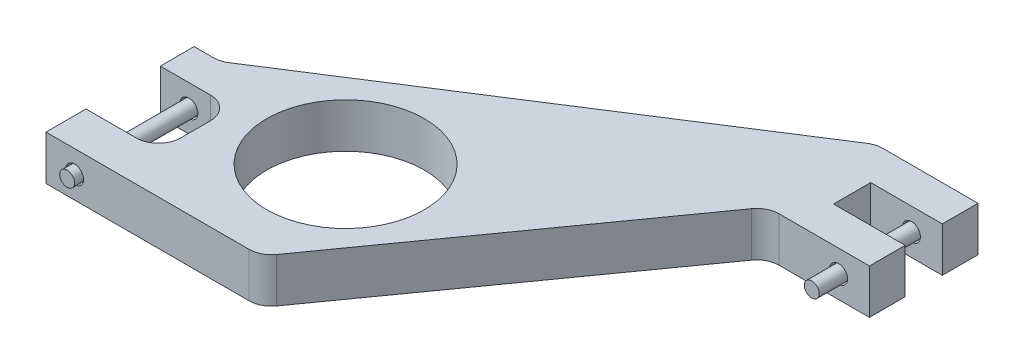
from build123d import *

# Parameters (mm, degrees)
SKETCH21_R     = 13.482411093
EXTRUDE1_DEPTH = 3.81
SKETCH22_R     = 1.524
EXTRUDE2_DEPTH = 64.8716
EXTRUDE3_START = 35.56
SKETCH23_R     = 1.27
EXTRUDE3_DEPTH = 30.574
EXTRUDE4_START = -5.08
SKETCH23_3_R   = 1.27
EXTRUDE4_DEPTH = 23.97


with BuildPart() as part:
    # Sketch21 → Extrude1 (new, symmetric)
    with BuildSketch(Plane(origin=(0, 0, 0), x_dir=(1, 0, 0), z_dir=(0, 1, 0))):
        with BuildLine():
            Line((-88.295770636, -45.311842545), (-79.727880739, -45.311842545))
            ThreePointArc((-79.727880739, -45.311842545), (-77.033803903, -46.427765709), (-75.917880739, -49.121842545))
            Line((-75.917880739, -49.121842545), (-75.917880739, -54.201842545))
            ThreePointArc((-75.917880739, -54.201842545), (-77.033803903, -56.895919382), (-79.727880739, -58.011842545))
            Line((-79.727880739, -58.011842545), (-88.295770636, -58.011842545))
            Line((-88.295770636, -58.011842545), (-88.295770636, -64.854185734))
            Line((-88.295770636, -64.854185734), (-70.51372875, -64.854185734))
            Line((-70.51372875, -64.854185734), (-53.559395609, -64.854185734))
            ThreePointArc((-53.559395609, -64.854185734), (-51.815232505, -64.431514338), (-50.458055152, -63.257280258))
            Line((-50.458055152, -63.257280258), (-16.653859035, -15.885457734))
            ThreePointArc((-16.653859035, -15.885457734), (-15.296681682, -14.711223655), (-13.552518579, -14.288552258))
            Line((-13.552518579, -14.288552258), (1.902726124, -14.288552258))
            Line((1.902726124, -14.288552258), (1.902726124, -8.186070905))
            Line((1.902726124, -8.186070905), (-10.334062324, -8.186070905))
            Line((-10.334062324, -8.186070905), (-10.334062324, -1.836070905))
            Line((-10.334062324, -1.836070905), (1.902726124, -1.836070905))
            Line((1.902726124, -1.836070905), (1.902726124, 4.266410449))
            Line((1.902726124, 4.266410449), (-14.39840261, 4.266410449))
            ThreePointArc((-14.39840261, 4.266410449), (-15.469328765, 4.112804461), (-16.453902861, 3.664372219))
            Line((-16.453902861, 3.664372219), (-82.93238161, -38.931687082))
            ThreePointArc((-82.93238161, -38.931687082), (-83.916955706, -39.380119324), (-84.987881861, -39.533725312))
            Line((-84.987881861, -39.533725312), (-88.295770636, -39.533725312))
            Line((-88.295770636, -39.533725312), (-88.295770636, -45.311842545))
        make_face()
        with Locations((-57.943964273, -43.997390879)):
            Circle(SKETCH21_R, mode=Mode.SUBTRACT)
    extrude(amount=EXTRUDE1_DEPTH, both=True)

    # Sketch22 → Extrude2 (cut, symmetric)
    with BuildSketch(Plane(origin=(-0.80037255, 0, 0), x_dir=(-1, 0, 0), z_dir=(0, 0, -1))):
        with Locations((2.563026803, 0)):
            Circle(SKETCH22_R)
        with Locations((82.598426803, 0)):
            Circle(SKETCH22_R)
    extrude(amount=EXTRUDE2_DEPTH, both=True, mode=Mode.SUBTRACT)


with BuildPart() as body_2:
    # Sketch23 → Extrude3 (new body)
    with BuildSketch(Plane.XY.offset(EXTRUDE3_START)):
        with Locations((-83.398799353, 0)):
            Circle(SKETCH23_R)
    extrude(amount=EXTRUDE3_DEPTH)


with BuildPart() as body_3:
    # Sketch23<3> → Extrude4 (new body)
    with BuildSketch(Plane.XY.offset(EXTRUDE4_START)):
        with Locations((-3.363399353, 0)):
            Circle(SKETCH23_3_R)
    extrude(amount=EXTRUDE4_DEPTH)


solid = Compound([part.part, body_2.part, body_3.part])
